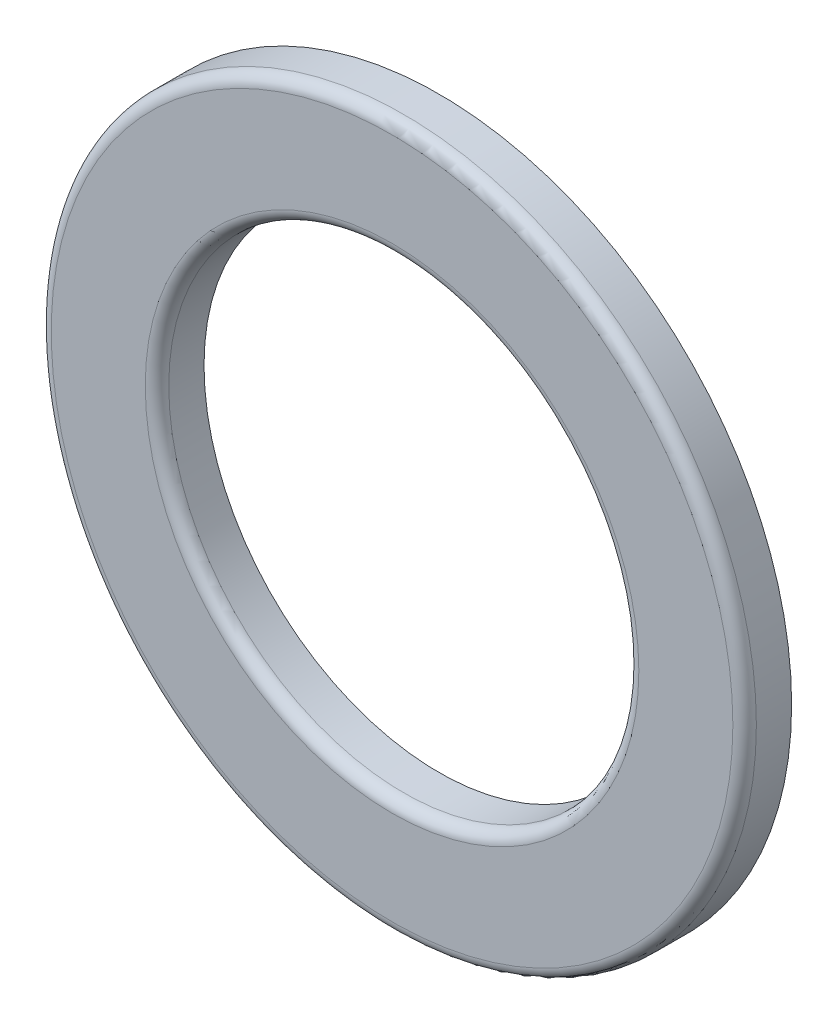
from build123d import *

# Parameters (mm, degrees)
SKETCH1_R           = 15
SKETCH1_R_2         = 10
BOSS_EXTRUDE1_DEPTH = 2
FILLET1_R           = 0.5


with BuildPart() as part:
    # Sketch1 → Boss-Extrude1 (new body)
    with BuildSketch(Plane.XY):
        Circle(SKETCH1_R)
        Circle(SKETCH1_R_2, mode=Mode.SUBTRACT)
    extrude(amount=BOSS_EXTRUDE1_DEPTH)

    # Fillet1
    fillet1_edges = [part.edges().sort_by_distance(p)[0] for p in [
        (-15, 0, 2),
        (-10, 0, 2),
    ]]
    fillet(fillet1_edges, radius=FILLET1_R)


solid = part.part
